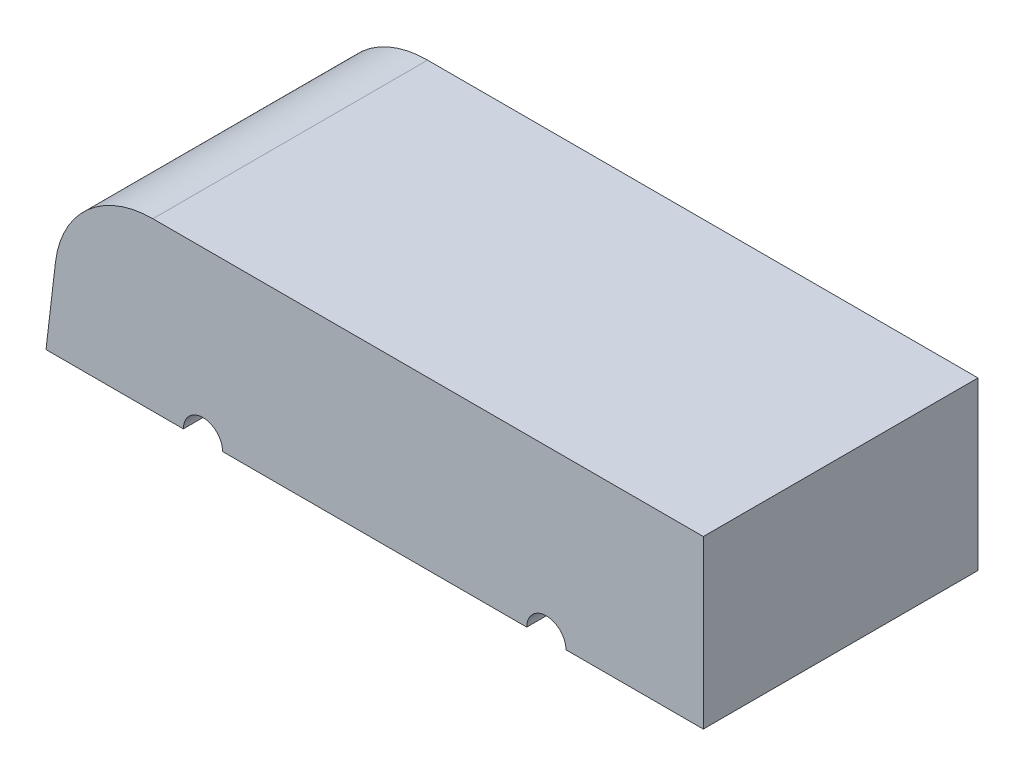
from build123d import *

# Parameters (mm, degrees)
BOSS_EXTRUDE1_DEPTH = 35.56
FILLET1_R           = 12.7


with BuildPart() as part:
    # Sketch1 → Boss-Extrude1 (new body)
    with BuildSketch(Plane.XY):
        with BuildLine():
            Line((85.09, 0), (85.09, 21.59))
            Line((85.09, 21.59), (2.54, 21.59))
            Line((2.54, 21.59), (0, 0))
            Line((0, 0), (17.78, 0))
            ThreePointArc((17.78, 0), (20.32, 2.54), (22.86, 0))
            Line((22.86, 0), (62.23, 0))
            ThreePointArc((62.23, 0), (64.77, 2.54), (67.31, 0))
            Line((67.31, 0), (85.09, 0))
        make_face()
    extrude(amount=BOSS_EXTRUDE1_DEPTH)

    # Fillet1
    fillet1_edges = [part.edges().sort_by_distance(p)[0] for p in [
        (2.54, 21.59, 17.78),
    ]]
    fillet(fillet1_edges, radius=FILLET1_R)


solid = part.part
